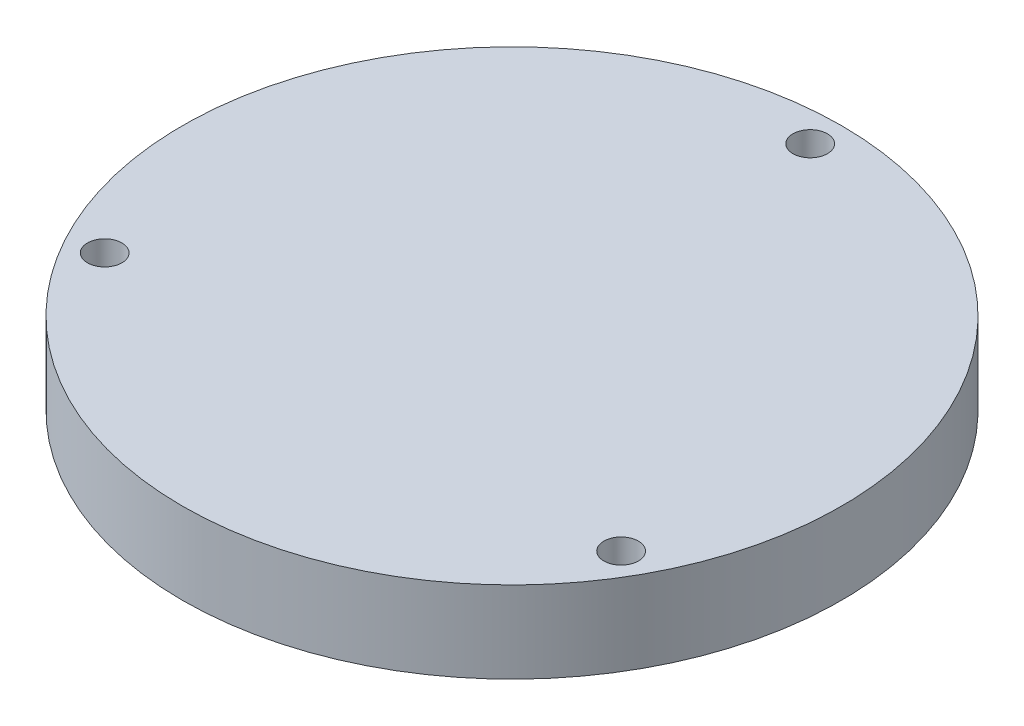
from build123d import *

# Parameters (mm, degrees)
ESQUISSE1_R             = 52.5
BOSS_EXTRU_1_DEPTH      = 10
ESQUISSE2_R             = 52.5
BOSS_EXTRU_2_DEPTH      = 3
ENL_V_START             = -3
ESQUISSE3_R             = 2.75
ENL_V_MAT_EXTRU_2_DEPTH = 73.375725535
ESQUISSE4_R             = 1.55
ENL_V_MAT_EXTRU_3_DEPTH = 76.375725535


with BuildPart() as part:
    # Esquisse1 → Boss.-Extru.1 (new body)
    with BuildSketch(Plane(origin=(0, 0, 0), x_dir=(1, 0, 0), z_dir=(0, 1, 0))):
        with Locations(Location((0, 0, 0), (0, 0, 270))):
            Circle(ESQUISSE1_R)
        with BuildLine():
            ThreePointArc((-4, 47.5), (0, 43.5), (4, 47.5))
            Line((4, 47.5), (4, 48.127435003))
            ThreePointArc((4, 48.127435003), (4.676150568, 49.626575651), (6.24742268, 50.112071498))
            ThreePointArc((6.24742268, 50.112071498), (43.734282891, 25.25), (46.522038294, -19.645609))
            ThreePointArc((46.522038294, -19.645609), (45.3159505, -20.763622642), (43.679581332, -20.599615887))
            Line((43.679581332, -20.599615887), (43.13620668, -20.285898385))
            ThreePointArc((43.13620668, -20.285898385), (37.672105065, -21.75), (39.13620668, -27.214101615))
            Line((39.13620668, -27.214101615), (39.679581332, -27.527819117))
            ThreePointArc((39.679581332, -27.527819117), (40.639799932, -28.862953009), (40.274615614, -30.466462499))
            ThreePointArc((40.274615614, -30.466462499), (0, -50.5), (-40.274615614, -30.466462499))
            ThreePointArc((-40.274615614, -30.466462499), (-40.639799932, -28.862953009), (-39.679581332, -27.527819117))
            Line((-39.679581332, -27.527819117), (-39.13620668, -27.214101615))
            ThreePointArc((-39.13620668, -27.214101615), (-37.672105065, -21.75), (-43.13620668, -20.285898385))
            Line((-43.13620668, -20.285898385), (-43.679581332, -20.599615887))
            ThreePointArc((-43.679581332, -20.599615887), (-45.3159505, -20.763622642), (-46.522038294, -19.645609))
            ThreePointArc((-46.522038294, -19.645609), (-43.734282891, 25.25), (-6.24742268, 50.112071498))
            ThreePointArc((-6.24742268, 50.112071498), (-4.676150568, 49.626575651), (-4, 48.127435003))
            Line((-4, 48.127435003), (-4, 47.5))
        make_face(mode=Mode.SUBTRACT)
    extrude(amount=BOSS_EXTRU_1_DEPTH)

    # Esquisse2 → Boss.-Extru.2 (add)
    with BuildSketch(Plane(origin=(0, 10, 0), x_dir=(1, 0, 0), z_dir=(0, 1, 0))):
        with Locations(Location((0, 0, 0), (0, 0, 270))):
            Circle(ESQUISSE2_R)
    extrude(amount=BOSS_EXTRU_2_DEPTH)

    # Esquisse3 → Enlèv. mat.-Extru.2 (cut, through all)
    with BuildSketch(Plane.XZ.offset(ENL_V_START)):
        with Locations(Location((0, -47.5, 0), (0, 0, 270))):
            Circle(ESQUISSE3_R)
        with Locations(Location((-41.13620668, 23.75, 0), (0, 0, 270))):
            Circle(ESQUISSE3_R)
        with Locations(Location((41.13620668, 23.75, 0), (0, 0, 270))):
            Circle(ESQUISSE3_R)
    extrude(amount=-ENL_V_MAT_EXTRU_2_DEPTH, mode=Mode.SUBTRACT)

    # Esquisse4 → Enlèv. mat.-Extru.3 (cut, through all)
    with BuildSketch(Plane.XZ):
        with Locations(Location((0, -47.5, 0), (0, 0, 270))):
            Circle(ESQUISSE4_R)
        with Locations(Location((-41.13620668, 23.75, 0), (0, 0, 270))):
            Circle(ESQUISSE4_R)
        with Locations(Location((41.13620668, 23.75, 0), (0, 0, 270))):
            Circle(ESQUISSE4_R)
    extrude(amount=-ENL_V_MAT_EXTRU_3_DEPTH, mode=Mode.SUBTRACT)


solid = part.part
